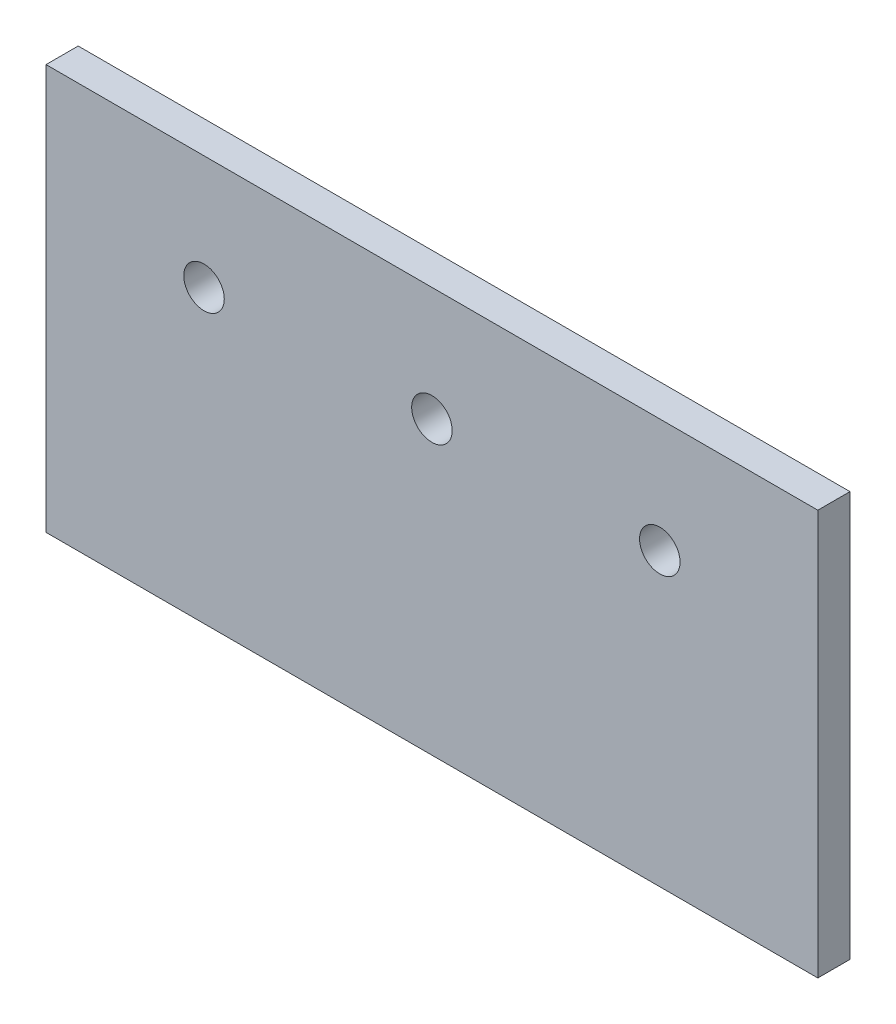
from build123d import *

# Parameters (mm, degrees)
SKETCH1_W           = 152.4
SKETCH1_H           = 80
SKETCH1_R           = 4
BOSS_EXTRUDE1_DEPTH = 6.35


with BuildPart() as part:
    # Sketch1 → Boss-Extrude1 (new body)
    with BuildSketch(Plane.XY):
        with Locations((76.2, -40)):
            Rectangle(SKETCH1_W, SKETCH1_H)
        with Locations((76.2, -22.5)):
            Circle(SKETCH1_R, mode=Mode.SUBTRACT)
        with Locations((31.2, -22.5)):
            Circle(SKETCH1_R, mode=Mode.SUBTRACT)
        with Locations((121.2, -22.5)):
            Circle(SKETCH1_R, mode=Mode.SUBTRACT)
    extrude(amount=BOSS_EXTRUDE1_DEPTH)


solid = part.part
